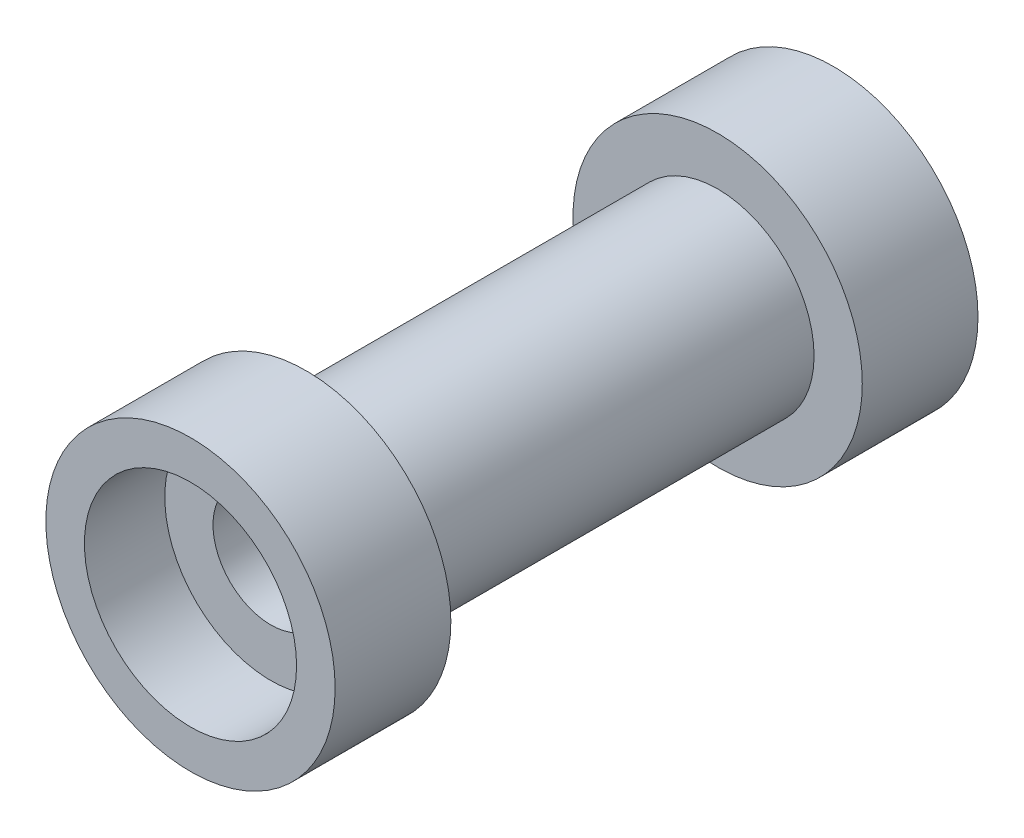
from build123d import *


with BuildPart() as part:
    # Sketch1 → Revolve1 (revolve)
    with BuildSketch(Plane(origin=(0, 0, 0), x_dir=(1, 0, 0), z_dir=(0, 1, 0)), mode=Mode.PRIVATE) as revolve1_sk:
        Polygon((-6, -12.8), (-6, 12.8), (-9, 12.8), (-9, 20), (-6.6, 20), (-6.6, 15), (-3.6, 15), (-3.6, -15), (-6.6, -15), (-6.6, -20), (-9, -20), (-9, -12.8), align=None)
    revolve(revolve1_sk.sketch.rotate(Axis((0, 0, 0), (0, 0, -1)), 180), axis=Axis((0, 0, 0), (0, 0, -1)))


solid = part.part
